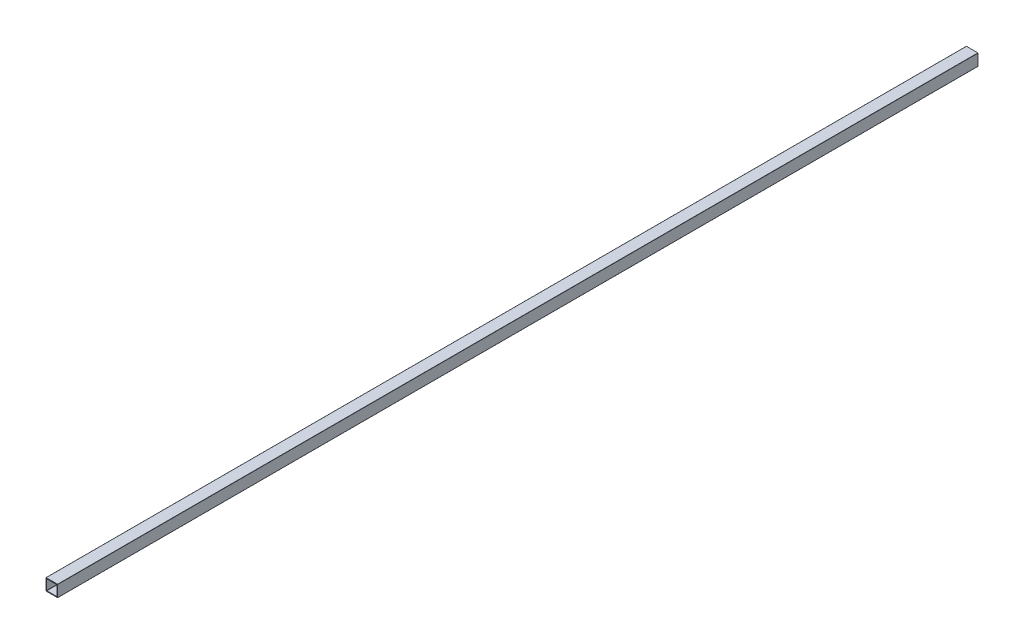
from build123d import *

# Parameters (mm, degrees)
CROQUIS1_W              = 76.2
CROQUIS1_H              = 76.2
CROQUIS1_W_2            = 67.1
CROQUIS1_H_2            = 67.1
SALIENTE_EXTRUIR1_DEPTH = 6000
REDONDEO1_R             = 1


with BuildPart() as part:
    # Croquis1 → Saliente-Extruir1 (new body)
    with BuildSketch(Plane.XY):
        Rectangle(CROQUIS1_W, CROQUIS1_H)
        Rectangle(CROQUIS1_W_2, CROQUIS1_H_2, mode=Mode.SUBTRACT)
    extrude(amount=-SALIENTE_EXTRUIR1_DEPTH)

    # Redondeo1
    redondeo1_edges = [part.edges().sort_by_distance(p)[0] for p in [
        (33.55, -33.55, -3000),
        (-33.55, -33.55, -3000),
        (-33.55, 33.55, -3000),
        (33.55, 33.55, -3000),
        (38.1, -38.1, -3000),
        (-38.1, -38.1, -3000),
        (-38.1, 38.1, -3000),
        (38.1, 38.1, -3000),
    ]]
    fillet(redondeo1_edges, radius=REDONDEO1_R)


solid = part.part
